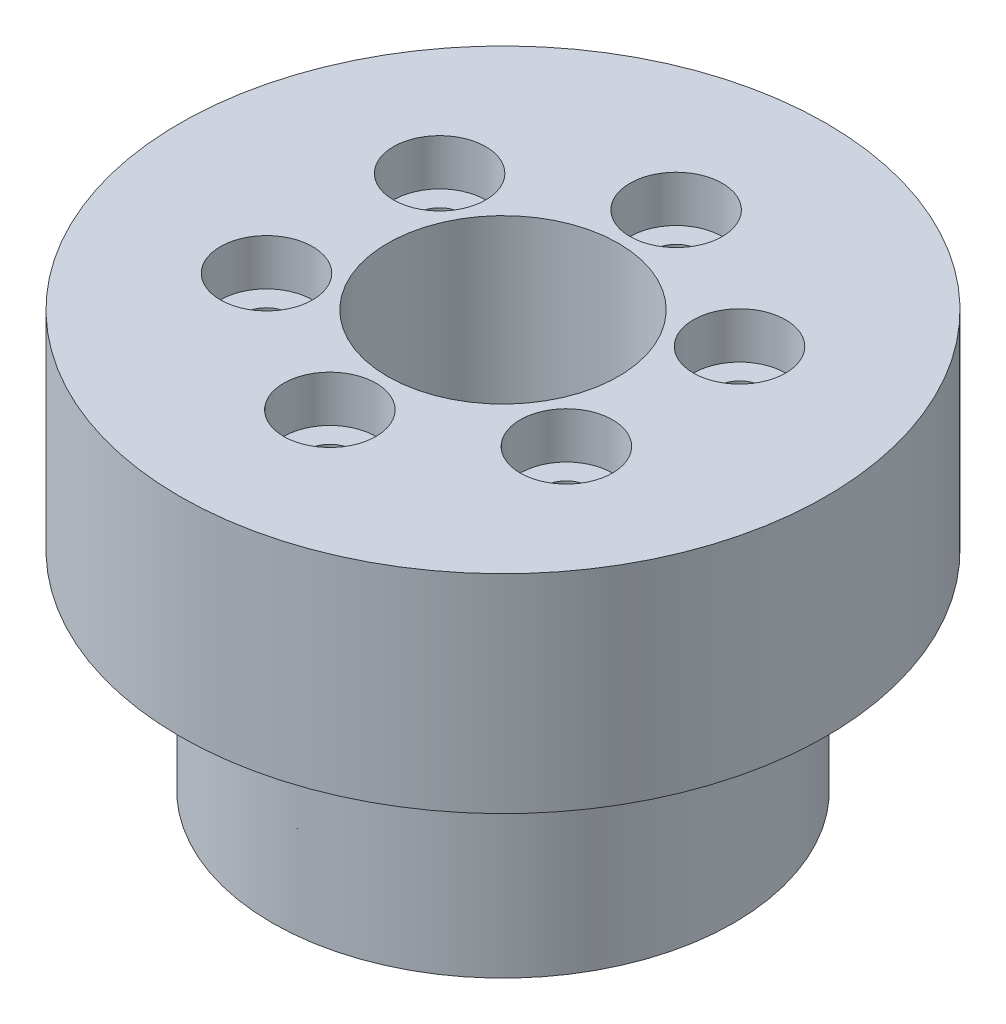
from build123d import *

# Parameters (mm, degrees)
SKETCH2_R          = 2
CUT_EXTRUDE1_DEPTH = 54.516352641
SKETCH3_R          = 10
CUT_EXTRUDE2_DEPTH = 54.516352641
SKETCH4_R          = 4
CUT_EXTRUDE3_DEPTH = 4


with BuildPart() as part:
    # Sketch1 → Revolve1 (revolve)
    with BuildSketch(Plane.XY, mode=Mode.PRIVATE) as revolve1_sk:
        Polygon((0, 0), (20, 0), (20, 18), (28, 18), (28, 36), (0, 36), align=None)
    revolve(revolve1_sk.sketch.rotate(Axis((0, 36, 0), (0, -1, 0)), 90), axis=Axis((0, 36, 0), (0, -1, 0)))

    # Sketch2 → Cut-Extrude1 (cut, through all)
    with BuildSketch(Plane(origin=(0, 36, 0), x_dir=(1, 0, 0), z_dir=(0, 1, 0))):
        with Locations(Location((0, 15, 0), (0, 0, 180))):
            Circle(SKETCH2_R)
        with Locations(Location((12.990381057, 7.5, 0), (0, 0, 180))):
            Circle(SKETCH2_R)
        with Locations(Location((12.990381057, -7.5, 0), (0, 0, 180))):
            Circle(SKETCH2_R)
        with Locations(Location((0, -15, 0), (0, 0, 180))):
            Circle(SKETCH2_R)
        with Locations(Location((-12.990381057, -7.5, 0), (0, 0, 180))):
            Circle(SKETCH2_R)
        with Locations(Location((-12.990381057, 7.5, 0), (0, 0, 180))):
            Circle(SKETCH2_R)
    extrude(amount=-CUT_EXTRUDE1_DEPTH, mode=Mode.SUBTRACT)

    # Sketch3 → Cut-Extrude2 (cut, through all)
    with BuildSketch(Plane(origin=(0, 36, 0), x_dir=(1, 0, 0), z_dir=(0, 1, 0))):
        with Locations(Location((0, 0, 0), (0, 0, 270))):
            Circle(SKETCH3_R)
    extrude(amount=-CUT_EXTRUDE2_DEPTH, mode=Mode.SUBTRACT)

    # Sketch4 → Cut-Extrude3 (cut)
    with BuildSketch(Plane(origin=(0, 36, 0), x_dir=(1, 0, 0), z_dir=(0, 1, 0))):
        with Locations(Location((0, 15, 0), (0, 0, 270))):
            Circle(SKETCH4_R)
        with Locations(Location((12.990381057, 7.5, 0), (0, 0, 270))):
            Circle(SKETCH4_R)
        with Locations(Location((12.990381057, -7.5, 0), (0, 0, 270))):
            Circle(SKETCH4_R)
        with Locations(Location((0, -15, 0), (0, 0, 270))):
            Circle(SKETCH4_R)
        with Locations(Location((-12.990381057, -7.5, 0), (0, 0, 270))):
            Circle(SKETCH4_R)
        with Locations(Location((-12.990381057, 7.5, 0), (0, 0, 270))):
            Circle(SKETCH4_R)
    extrude(amount=-CUT_EXTRUDE3_DEPTH, mode=Mode.SUBTRACT)


solid = part.part
